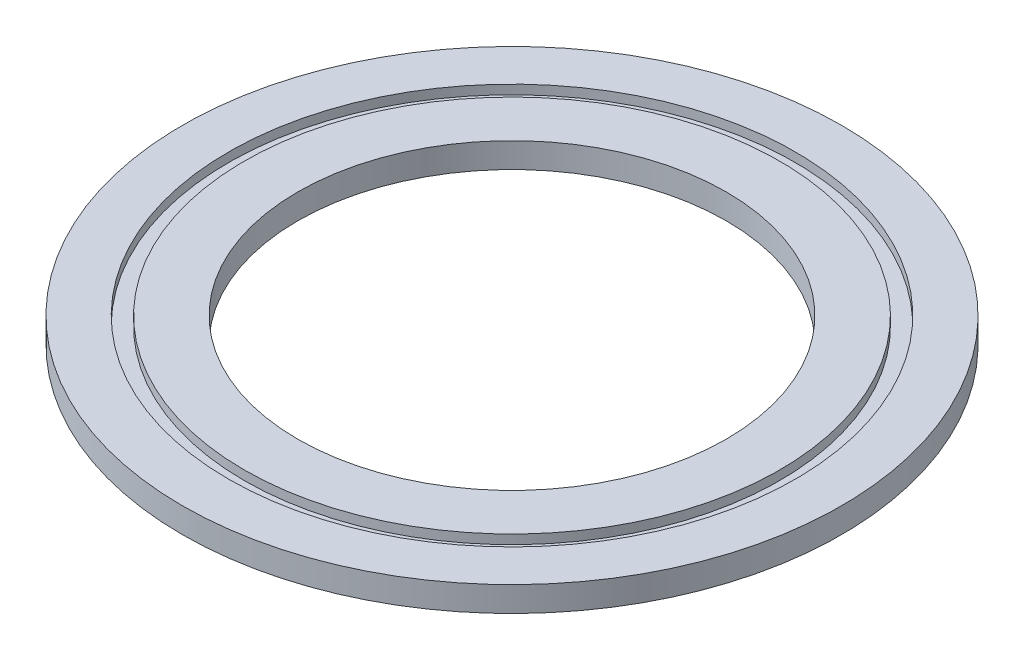
from build123d import *

# Parameters (mm, degrees)
SKETCH1_R           = 250
SKETCH1_R_2         = 162.5
BOSS_EXTRUDE1_DEPTH = 19
SKETCH2_R           = 215
SKETCH2_R_2         = 203
CUT_EXTRUDE1_DEPTH  = 7


with BuildPart() as part:
    # Sketch1 → Boss-Extrude1 (new body)
    with BuildSketch(Plane(origin=(0, 0, 0), x_dir=(1, 0, 0), z_dir=(0, 1, 0))):
        with Locations(Location((0, 0, 0), (0, 0, 270))):
            Circle(SKETCH1_R)
        with Locations(Location((0, 0, 0), (0, 0, 270))):
            Circle(SKETCH1_R_2, mode=Mode.SUBTRACT)
    extrude(amount=BOSS_EXTRUDE1_DEPTH)

    # Sketch2 → Cut-Extrude1 (cut)
    with BuildSketch(Plane(origin=(0, 19, 0), x_dir=(1, 0, 0), z_dir=(0, 1, 0))):
        with Locations(Location((0, 0, 0), (0, 0, 270))):
            Circle(SKETCH2_R)
        with Locations(Location((0, 0, 0), (0, 0, 270))):
            Circle(SKETCH2_R_2, mode=Mode.SUBTRACT)
    extrude(amount=-CUT_EXTRUDE1_DEPTH, mode=Mode.SUBTRACT)


solid = part.part
